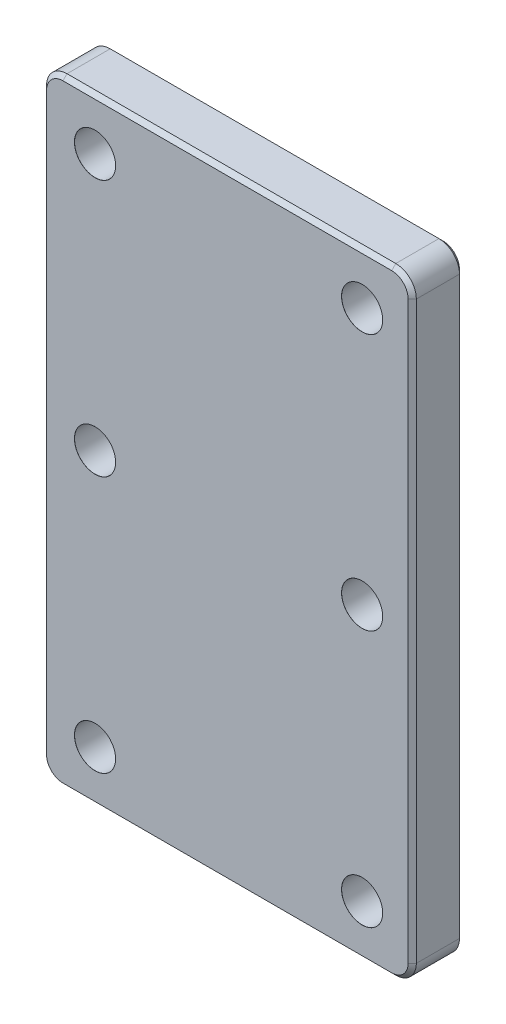
from build123d import *

# Parameters (mm, degrees)
BOSS_EXTRUDE1_DEPTH                  = 12.5
F_20_0_20_DIAMETER_HOLE1_D           = 20
F_20_0_20_DIAMETER_HOLE1_CSINK_D     = 20.05
F_20_0_20_DIAMETER_HOLE1_CSINK_ANGLE = 90
CHAMFER2_SIZE                        = 2
CHAMFER3_SIZE                        = 2


with BuildPart() as part:
    # Sketch2 → Boss-Extrude1 (new, symmetric)
    with BuildSketch(Plane(origin=(0, 0, 0), x_dir=(0, 1, 0), z_dir=(0, 0, 1))):
        with BuildLine():
            Line((-140, -90), (140, -90))
            ThreePointArc((140, -90), (147.071067812, -87.071067812), (150, -80))
            Line((150, -80), (150, 80))
            ThreePointArc((150, 80), (147.071067812, 87.071067812), (140, 90))
            Line((140, 90), (-140, 90))
            ThreePointArc((-140, 90), (-147.071067812, 87.071067812), (-150, 80))
            Line((-150, 80), (-150, -80))
            ThreePointArc((-150, -80), (-147.071067812, -87.071067812), (-140, -90))
        make_face()
    extrude(amount=BOSS_EXTRUDE1_DEPTH, both=True)

    # Ø20.0 (20) Diameter Hole1 (through all)
    with Locations(Plane(origin=(-64.383356152, -125, 12.5), x_dir=(1, 0, 0), z_dir=(0, 0, 1))):
        with Locations((0, 0), (0, 125), (0, 250), (130, 250), (130, 125), (130, 0)):
            CounterSinkHole(F_20_0_20_DIAMETER_HOLE1_D / 2, F_20_0_20_DIAMETER_HOLE1_CSINK_D / 2, counter_sink_angle=F_20_0_20_DIAMETER_HOLE1_CSINK_ANGLE)

    # Chamfer2
    chamfer2_edges = [part.edges().sort_by_distance(p)[0] for p in [
        (87.071067812, 147.071067812, 12.5),
        (0, 150, 12.5),
        (-87.071067812, 147.071067812, 12.5),
        (-90, 0, 12.5),
        (-87.071067812, -147.071067812, 12.5),
        (0, -150, 12.5),
        (87.071067812, -147.071067812, 12.5),
        (90, 0, 12.5),
    ]]
    chamfer(chamfer2_edges, length=CHAMFER2_SIZE)

    # Chamfer3
    chamfer3_edges = [part.edges().sort_by_distance(p)[0] for p in [
        (0, 150, -12.5),
        (87.071067812, 147.071067812, -12.5),
        (90, 0, -12.5),
        (87.071067812, -147.071067812, -12.5),
        (75.616643848, -125, -12.5),
        (75.616643848, 0, -12.5),
        (75.616643848, 125, -12.5),
        (-54.383356152, 125, -12.5),
        (-54.383356152, 0, -12.5),
        (-54.383356152, -125, -12.5),
        (0, -150, -12.5),
        (-87.071067812, -147.071067812, -12.5),
        (-90, 0, -12.5),
        (-87.071067812, 147.071067812, -12.5),
    ]]
    chamfer(chamfer3_edges, length=CHAMFER3_SIZE)


solid = part.part
